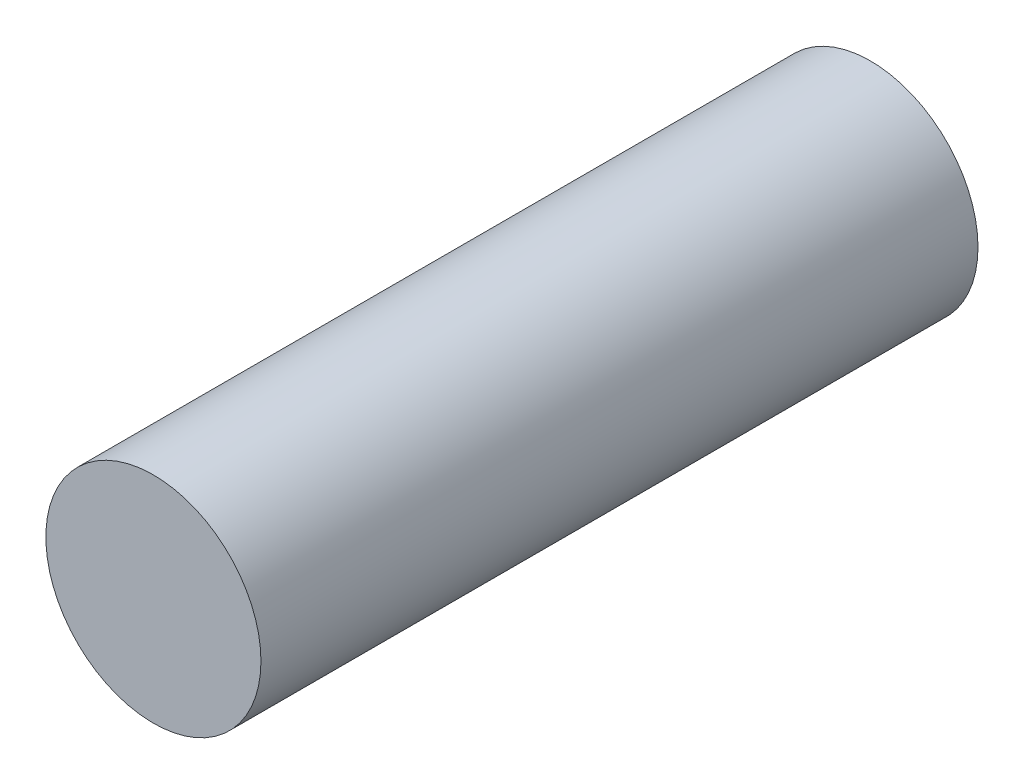
from build123d import *

# Parameters (mm, degrees)
SKETCH1_R           = 9
BOSS_EXTRUDE1_DEPTH = 60


with BuildPart() as part:
    # Sketch1 → Boss-Extrude1 (new body)
    with BuildSketch(Plane.XY):
        Circle(SKETCH1_R)
    extrude(amount=BOSS_EXTRUDE1_DEPTH)


solid = part.part
